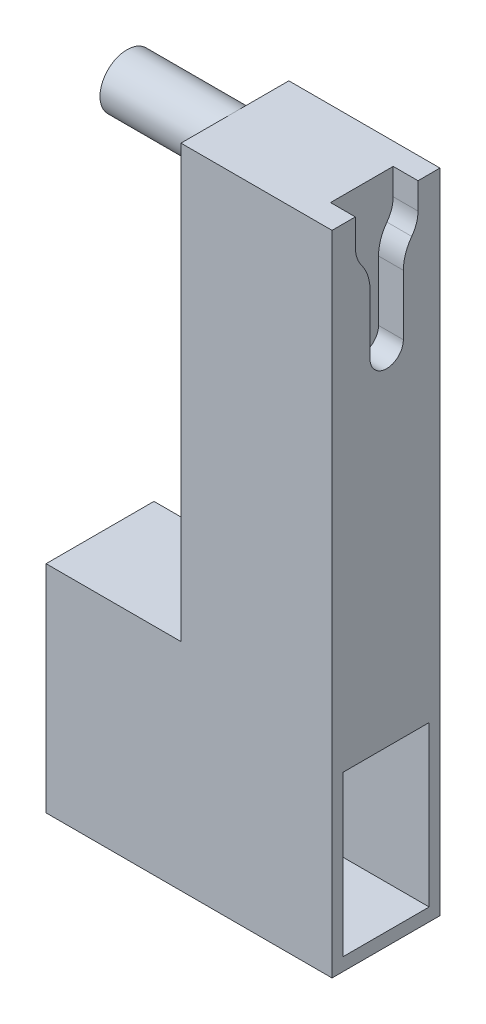
from build123d import *

# Parameters (mm, degrees)
SKETCH1_W               = 35.56
SKETCH1_H               = 25.4
BOSS_EXTRUDE1_DEPTH     = 25.4
SKETCH2_R               = 6.35
BOSS_EXTRUDE2_DEPTH     = 25.4
SKETCH4_R               = 1.395358984
CUT_EXTRUDE1_DEPTH      = 5.842
SKETCH7_W               = 35.56
SKETCH7_H               = 25.4
BOSS_EXTRUDE3_DEPTH     = 101.6
CUT_EXTRUDE2_DEPTH      = 142.44402285
CUT_EXTRUDE2_DEPTH_BACK = 12.7
SKETCH4_4_R             = 1.395358984
SKETCH10_W              = 25.4
SKETCH10_H              = 50.8
BOSS_EXTRUDE4_DEPTH     = 31.75
SKETCH11_W              = 20.32
SKETCH11_H              = 37.592
CUT_EXTRUDE3_DEPTH      = 49.53


with BuildPart() as part:
    # Sketch1 → Boss-Extrude1 (new, symmetric)
    with BuildSketch(Plane(origin=(0, 0, 0), x_dir=(1, 0, 0), z_dir=(0, 1, 0))):
        Rectangle(SKETCH1_W, SKETCH1_H)
    extrude(amount=BOSS_EXTRUDE1_DEPTH, both=True)

    # Sketch2 → Boss-Extrude2 (add, symmetric)
    with BuildSketch(Plane.ZY.offset(17.78)):
        with Locations((0, 19.05)):
            Circle(SKETCH2_R)
    extrude(amount=BOSS_EXTRUDE2_DEPTH, both=True)

    # Sketch4 → Cut-Extrude1 (cut)
    with BuildSketch(Plane(origin=(17.78, 0, 0), x_dir=(0, 0, -1), z_dir=(1, 0, 0))):
        with BuildLine():
            ThreePointArc((-5.7416, 14.7838), (-4.273649798, 11.982116734), (-3.767, 8.86))
            Line((-3.767, 8.86), (-3.767, -5.29))
            ThreePointArc((-3.767, -5.29), (0.16, -9.217), (4.087, -5.29))
            Line((4.087, -5.29), (4.087, 8.86))
            ThreePointArc((4.087, 8.86), (4.593649798, 11.982116734), (6.0616, 14.7838))
            ThreePointArc((6.0616, 14.7838), (7.15843669, 16.87718777), (7.537, 19.21))
            Line((7.537, 19.21), (7.537, 26.587))
            Line((7.537, 26.587), (-7.217, 26.587))
            Line((-7.217, 26.587), (-7.217, 19.21))
            ThreePointArc((-7.217, 19.21), (-6.83843669, 16.87718777), (-5.7416, 14.7838))
        make_face()
        with Locations((0.16, -5.29)):
            Circle(SKETCH4_R, mode=Mode.SUBTRACT)
        with Locations((0.16, -1.29)):
            Circle(SKETCH4_R, mode=Mode.SUBTRACT)
    extrude(amount=-CUT_EXTRUDE1_DEPTH, mode=Mode.SUBTRACT)

    # Sketch7 → Boss-Extrude3 (add)
    with BuildSketch(Plane.XZ.offset(25.4)):
        Rectangle(SKETCH7_W, SKETCH7_H)
    extrude(amount=BOSS_EXTRUDE3_DEPTH)

    # Sketch4<4> → Cut-Extrude2 (cut, two sides: drawn at the far end of the back side and taken through both)
    with BuildSketch(Plane(origin=(17.78, 0, 0), x_dir=(0, 0, -1), z_dir=(1, 0, 0)).offset(-CUT_EXTRUDE2_DEPTH_BACK)):
        with Locations((0.16, -1.29)):
            Circle(SKETCH4_4_R)
        with Locations((0.16, -5.29)):
            Circle(SKETCH4_4_R)
    extrude(amount=CUT_EXTRUDE2_DEPTH + CUT_EXTRUDE2_DEPTH_BACK, mode=Mode.SUBTRACT)

    # Sketch10 → Boss-Extrude4 (add)
    with BuildSketch(Plane.ZY.offset(17.78)):
        with Locations((0, -101.6)):
            Rectangle(SKETCH10_W, SKETCH10_H)
    extrude(amount=BOSS_EXTRUDE4_DEPTH)

    # Sketch11 → Cut-Extrude3 (cut)
    with BuildSketch(Plane(origin=(17.78, 0, 0), x_dir=(0, 0, -1), z_dir=(1, 0, 0))):
        with Locations((0, -105.156)):
            Rectangle(SKETCH11_W, SKETCH11_H)
    extrude(amount=-CUT_EXTRUDE3_DEPTH, mode=Mode.SUBTRACT)


solid = part.part
